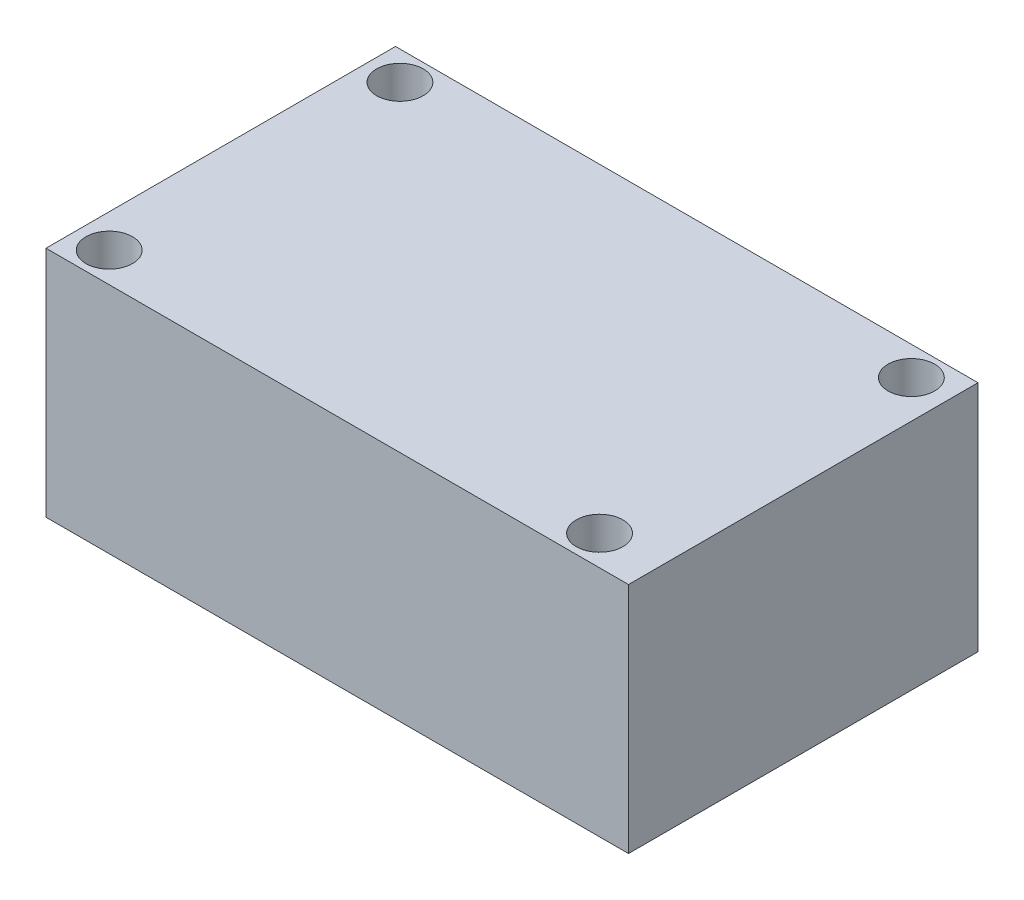
from build123d import *

# Parameters (mm, degrees)
SKETCH_1_W          = 25
SKETCH_1_H          = 15
EXTRUDE_1_DEPTH     = 10
SKETCH_2_R          = 1
CUT_EXTRUDE_1_DEPTH = 20.939533094


with BuildPart() as part:
    # 草图1 → 凸台-拉伸1 (new body)
    with BuildSketch(Plane(origin=(0, 0, 0), x_dir=(1, 0, 0), z_dir=(0, 1, 0))):
        with Locations((-2.08203125, -1.716796875)):
            Rectangle(SKETCH_1_W, SKETCH_1_H)
    extrude(amount=EXTRUDE_1_DEPTH)

    # 草图2 → 切除-拉伸1 (cut, through all)
    with BuildSketch(Plane(origin=(0, 10, 0), x_dir=(1, 0, 0), z_dir=(0, 1, 0))):
        with Locations(Location((-13.153935314, 4.545520989, 0), (0, 0, 270))):
            Circle(SKETCH_2_R)
        with Locations(Location((-13.153935314, -7.932342221, 0), (0, 0, 270))):
            Circle(SKETCH_2_R)
        with Locations(Location((8.795526254, 4.545520989, 0), (0, 0, 270))):
            Circle(SKETCH_2_R)
        with Locations(Location((7.891153208, -7.932342221, 0), (0, 0, 270))):
            Circle(SKETCH_2_R)
    extrude(amount=-CUT_EXTRUDE_1_DEPTH, mode=Mode.SUBTRACT)


solid = part.part
